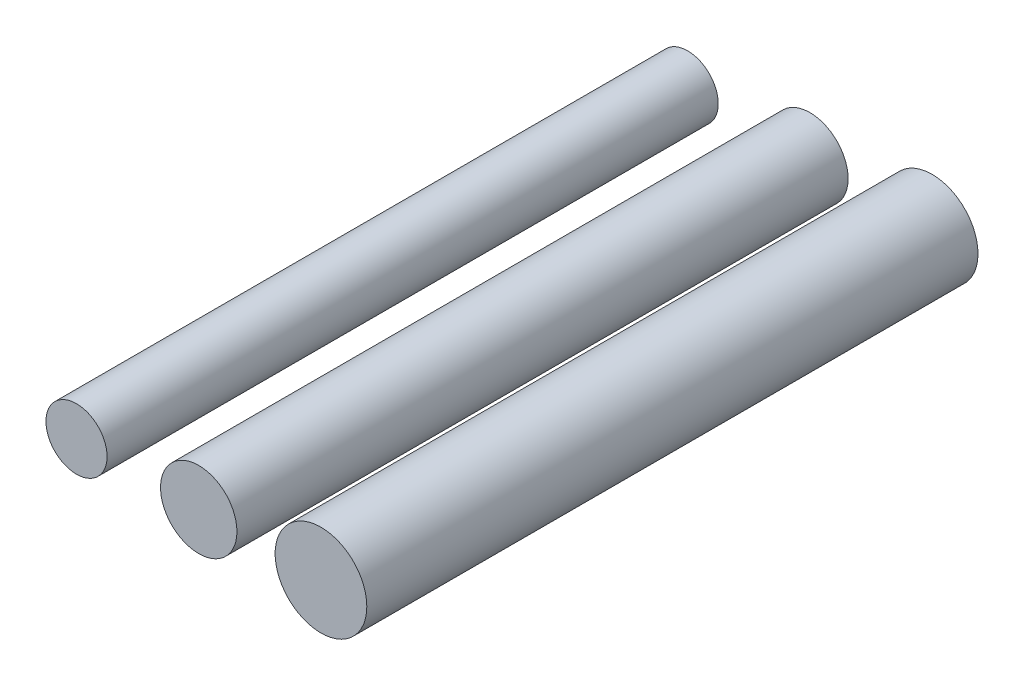
from build123d import *

# Parameters (mm, degrees)
SKETCH1_R             = 1.27
BOSS_EXTRUDE1_DEPTH   = 25.4
SKETCH1_R_2           = 1.5875
BOSS_EXTRUDE1_2_DEPTH = 25.4
SKETCH1_R_3           = 1.905
BOSS_EXTRUDE1_3_DEPTH = 25.4


with BuildPart() as part:
    # Sketch1 → Boss-Extrude1 (new body)
    with BuildSketch(Plane.XY):
        Circle(SKETCH1_R)
    extrude(amount=BOSS_EXTRUDE1_DEPTH)


with BuildPart() as body_2:
    # Sketch1 → Boss-Extrude1 2 (new body)
    with BuildSketch(Plane.XY):
        with Locations((5.08, 0)):
            Circle(SKETCH1_R_2)
    extrude(amount=BOSS_EXTRUDE1_2_DEPTH)


with BuildPart() as body_3:
    # Sketch1 → Boss-Extrude1 3 (new body)
    with BuildSketch(Plane.XY):
        with Locations((10.16, 0)):
            Circle(SKETCH1_R_3)
    extrude(amount=BOSS_EXTRUDE1_3_DEPTH)


solid = Compound([part.part, body_2.part, body_3.part])
